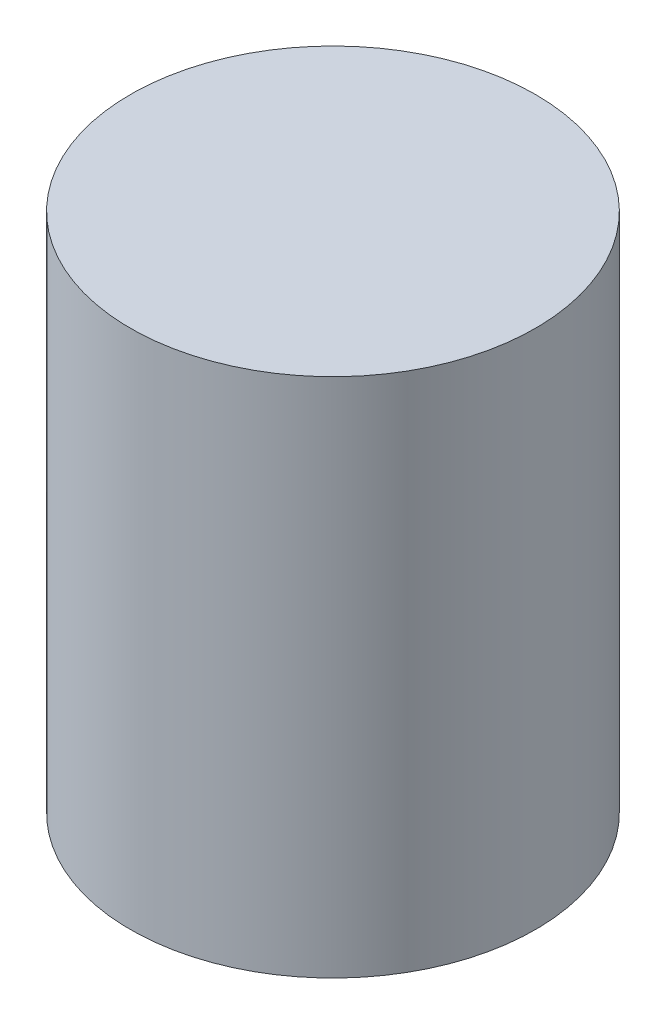
from build123d import *

# Parameters (mm, degrees)
SKETCH1_R           = 70
BOSS_EXTRUDE1_DEPTH = 180


with BuildPart() as part:
    # Sketch1 → Boss-Extrude1 (new body)
    with BuildSketch(Plane(origin=(0, 0, 0), x_dir=(1, 0, 0), z_dir=(0, 1, 0))):
        with Locations(Location((0, 0, 0), (0, 0, 90))):
            Circle(SKETCH1_R)
    extrude(amount=BOSS_EXTRUDE1_DEPTH)


solid = part.part
